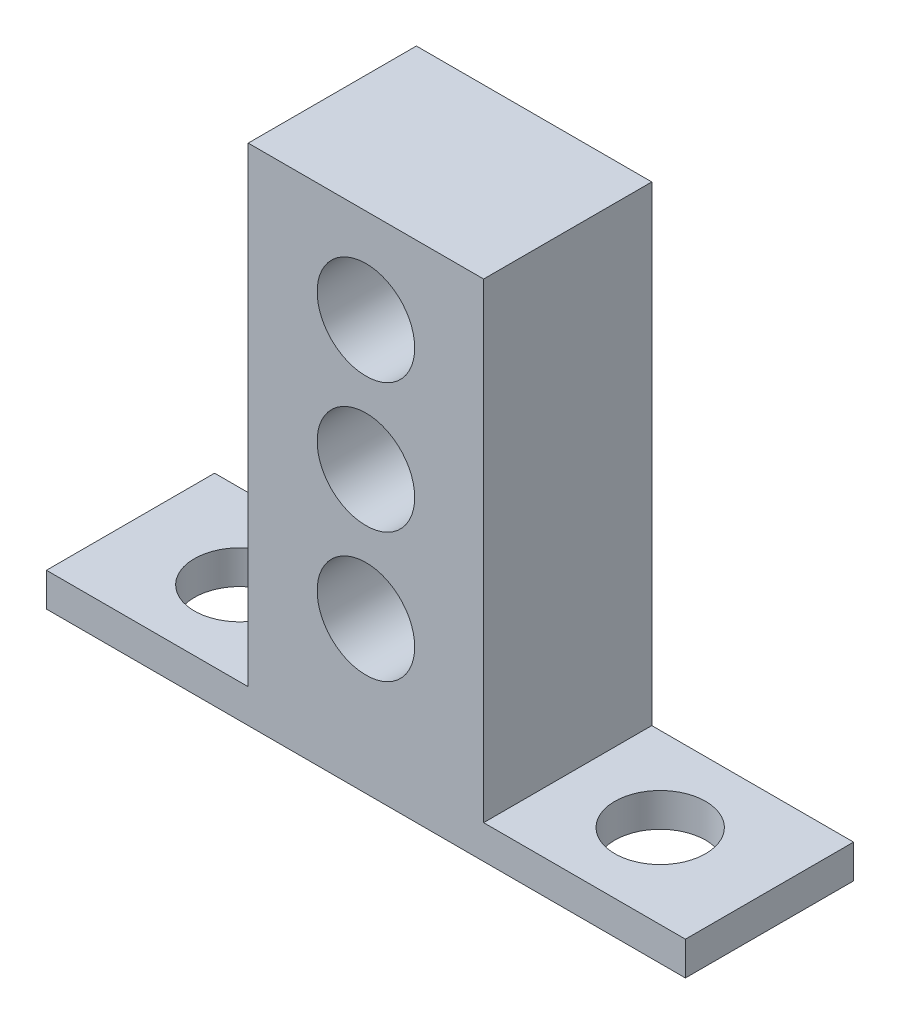
from build123d import *

# Parameters (mm, degrees)
SKETCH1_W           = 17.78
SKETCH1_H           = 38.1
SKETCH1_R           = 3.683
BOSS_EXTRUDE1_DEPTH = 12.7
SKETCH2_W           = 12.7
SKETCH2_H           = 2.54
BOSS_EXTRUDE2_DEPTH = 15.24
SKETCH3_W           = 12.7
SKETCH3_H           = 2.54
BOSS_EXTRUDE3_DEPTH = 15.24
SKETCH4_R           = 3.429
CUT_EXTRUDE1_DEPTH  = 52.992503306


with BuildPart() as part:
    # Sketch1 → Boss-Extrude1 (new body)
    with BuildSketch(Plane.XY):
        with Locations((8.89, 19.05)):
            Rectangle(SKETCH1_W, SKETCH1_H)
        with Locations((8.89, 30.988)):
            Circle(SKETCH1_R, mode=Mode.SUBTRACT)
        with Locations((8.89, 21.209)):
            Circle(SKETCH1_R, mode=Mode.SUBTRACT)
        with Locations((8.89, 11.43)):
            Circle(SKETCH1_R, mode=Mode.SUBTRACT)
    extrude(amount=BOSS_EXTRUDE1_DEPTH)

    # Sketch2 → Boss-Extrude2 (add)
    with BuildSketch(Plane(origin=(17.78, 0, 0), x_dir=(0, 0, -1), z_dir=(1, 0, 0))):
        with Locations((-6.35, 1.27)):
            Rectangle(SKETCH2_W, SKETCH2_H)
    extrude(amount=BOSS_EXTRUDE2_DEPTH)

    # Sketch3 → Boss-Extrude3 (add)
    with BuildSketch(Plane.ZY):
        with Locations((6.35, 1.27)):
            Rectangle(SKETCH3_W, SKETCH3_H)
    extrude(amount=BOSS_EXTRUDE3_DEPTH)

    # Sketch4 → Cut-Extrude1 (cut, through all)
    with BuildSketch(Plane.XZ):
        with Locations(Location((-6.985, 6.35, 0), (0, 0, 270))):
            Circle(SKETCH4_R)
        with Locations(Location((24.765, 6.35, 0), (0, 0, 270))):
            Circle(SKETCH4_R)
    extrude(amount=-CUT_EXTRUDE1_DEPTH, mode=Mode.SUBTRACT)


solid = part.part
